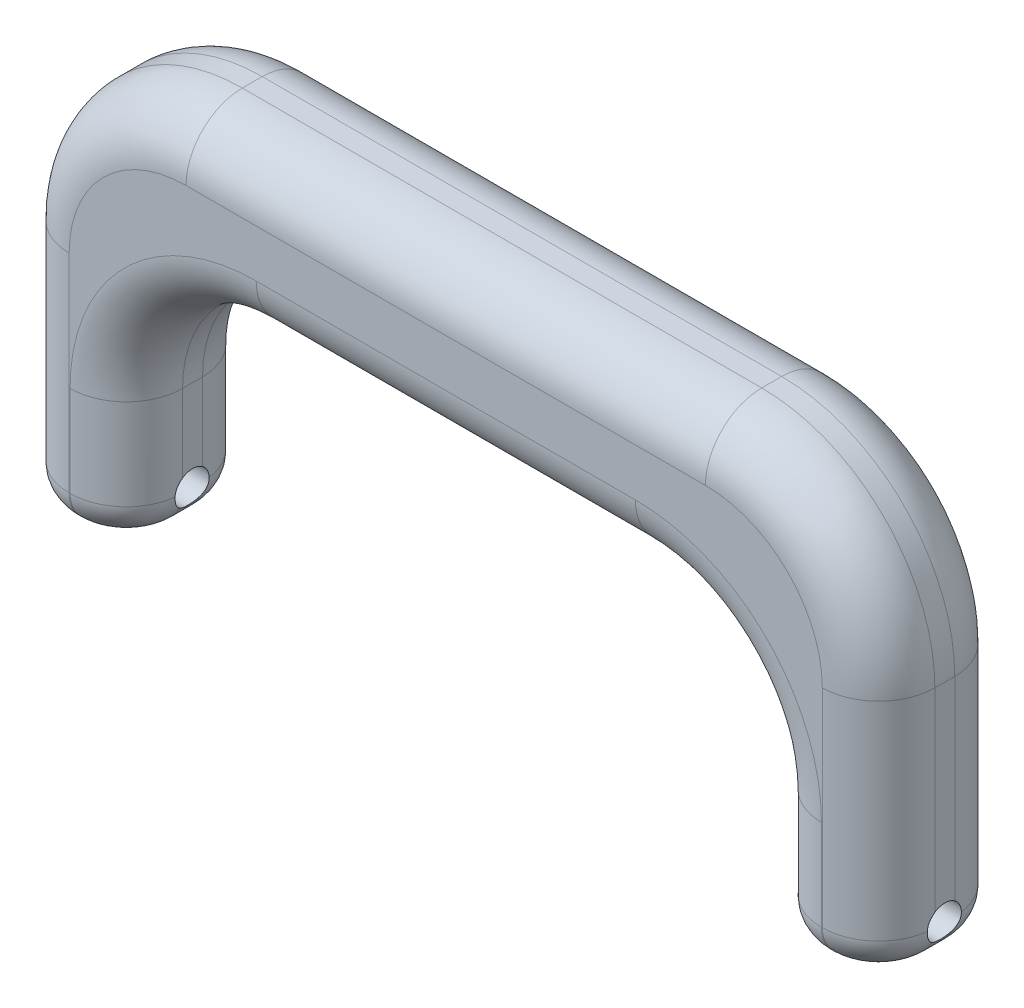
from build123d import *

# Parameters (mm, degrees)
BOSS_EXTRUDE1_DEPTH   = 9.7155
FILLET2_R             = 8.255
FILLET4_R             = 5.08
CROQUIS2_R            = 2.5
CORTAR_EXTRUIR2_DEPTH = 77.724


with BuildPart() as part:
    # Sketch1 → Boss-Extrude1 (new, symmetric)
    with BuildSketch(Plane.XY):
        with BuildLine():
            Line((-46.863, 0), (-46.863, 18.415))
            ThreePointArc((-46.863, 18.415), (-41.283384182, 31.885384182), (-27.813, 37.465))
            Line((-27.813, 37.465), (27.813, 37.465))
            ThreePointArc((27.813, 37.465), (41.283384182, 31.885384182), (46.863, 18.415))
            Line((46.863, 18.415), (46.863, 0))
            Line((46.863, 0), (63.5, 0))
            Line((63.5, 0), (63.5, 35.56))
            ThreePointArc((63.5, 35.56), (56.060512242, 53.520512242), (38.1, 60.96))
            Line((38.1, 60.96), (-38.1, 60.96))
            ThreePointArc((-38.1, 60.96), (-56.060512242, 53.520512242), (-63.5, 35.56))
            Line((-63.5, 35.56), (-63.5, 0))
            Line((-63.5, 0), (-46.863, 0))
        make_face()
    extrude(amount=BOSS_EXTRUDE1_DEPTH, both=True)

    # Fillet2
    fillet2_edges = [part.edges().sort_by_distance(p)[0] for p in [
        (56.060512242, 53.520512242, 9.7155),
        (-63.5, 17.78, -9.7155),
        (-46.863, 9.2075, -9.7155),
        (-41.283384182, 31.885384182, -9.7155),
        (0, 37.465, -9.7155),
        (41.283384182, 31.885384182, -9.7155),
        (63.5, 17.78, 9.7155),
        (46.863, 9.2075, -9.7155),
        (63.5, 17.78, -9.7155),
        (56.060512242, 53.520512242, -9.7155),
        (0, 60.96, -9.7155),
        (-56.060512242, 53.520512242, -9.7155),
        (46.863, 9.2075, 9.7155),
        (41.283384182, 31.885384182, 9.7155),
        (0, 37.465, 9.7155),
        (-41.283384182, 31.885384182, 9.7155),
        (-46.863, 9.2075, 9.7155),
        (-63.5, 17.78, 9.7155),
        (-56.060512242, 53.520512242, 9.7155),
        (0, 60.96, 9.7155),
    ]]
    fillet(fillet2_edges, radius=FILLET2_R)

    # Fillet4
    fillet4_edges = [part.edges().sort_by_distance(p)[0] for p in [
        (-55.1815, 0, 9.7155),
        (55.1815, 0, 9.7155),
        (-46.863, 0, 0),
        (-55.1815, 0, -9.7155),
        (-63.5, 0, 0),
        (-61.082166479, 0, 7.297666479),
        (-61.082166479, 0, -7.297666479),
        (-49.280833521, 0, -7.297666479),
        (-49.280833521, 0, 7.297666479),
        (46.863, 0, 0),
        (55.1815, 0, -9.7155),
        (63.5, 0, 0),
        (61.082166479, 0, 7.297666479),
        (61.082166479, 0, -7.297666479),
        (49.280833521, 0, -7.297666479),
        (49.280833521, 0, 7.297666479),
    ]]
    fillet(fillet4_edges, radius=FILLET4_R)

    # Croquis2 → Cortar-Extruir2 (cut, symmetric)
    with BuildSketch(Plane(origin=(0, 0, 0), x_dir=(0, 0, -1), z_dir=(1, 0, 0))):
        with Locations(Location((0, 5, 0), (0, 0, 1.833777999))):
            Circle(CROQUIS2_R)
    extrude(amount=CORTAR_EXTRUIR2_DEPTH, both=True, mode=Mode.SUBTRACT)


solid = part.part
